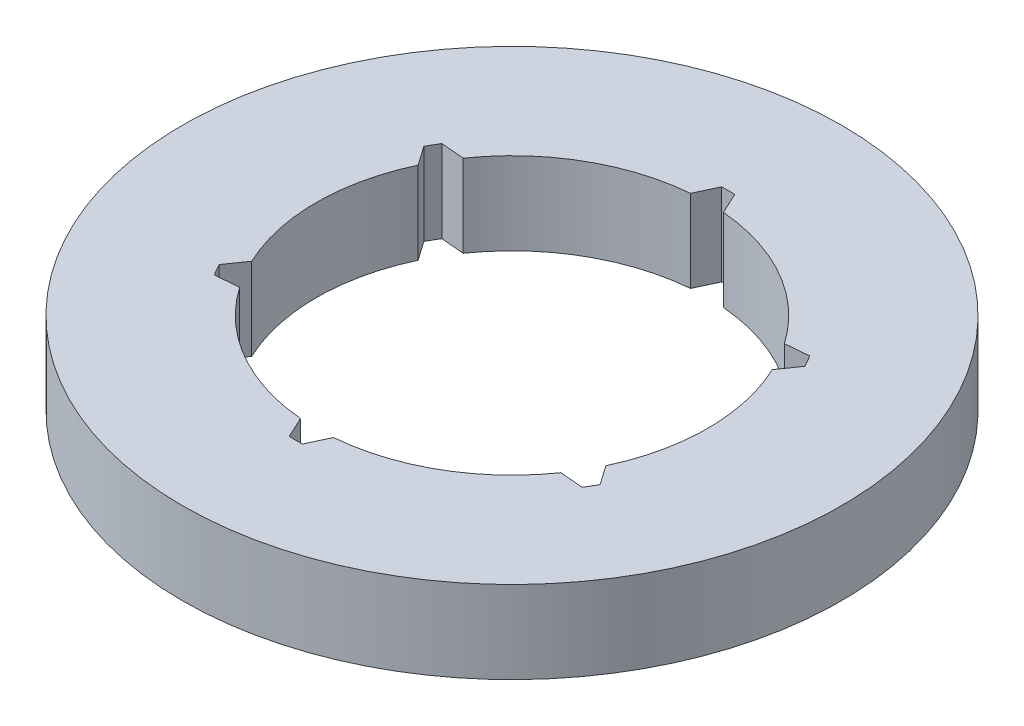
from build123d import *

# Parameters (mm, degrees)
SKETCH1_R           = 40
BOSS_EXTRUDE1_DEPTH = 10


with BuildPart() as part:
    # Sketch1 → Boss-Extrude1 (new body)
    with BuildSketch(Plane(origin=(0, 0, 0), x_dir=(1, 0, 0), z_dir=(0, 1, 0))):
        with Locations(Location((0, 0, 0), (0, 0, 270))):
            Circle(SKETCH1_R)
        with BuildLine():
            Line((-2, 23.665639649), (-0.800587161, 26.237788783))
            ThreePointArc((-0.800587161, 26.237788783), (0, 26.25), (0.800587161, 26.237788783))
            Line((0.800587161, 26.237788783), (2, 23.665639649))
            ThreePointArc((2, 23.665639649), (11.875, 20.56810334), (19.495045133, 13.564870632))
            Line((19.495045133, 13.564870632), (22.322298044, 13.812223211))
            ThreePointArc((22.322298044, 13.812223211), (22.733166849, 13.125), (23.122885205, 12.425565572))
            Line((23.122885205, 12.425565572), (21.495045133, 10.100769017))
            ThreePointArc((21.495045133, 10.100769017), (23.75, 0), (21.495045133, -10.100769017))
            Line((21.495045133, -10.100769017), (23.122885205, -12.425565572))
            ThreePointArc((23.122885205, -12.425565572), (22.733166849, -13.125), (22.322298044, -13.812223211))
            Line((22.322298044, -13.812223211), (19.495045133, -13.564870632))
            ThreePointArc((19.495045133, -13.564870632), (11.875, -20.56810334), (2, -23.665639649))
            Line((2, -23.665639649), (0.800587161, -26.237788783))
            ThreePointArc((0.800587161, -26.237788783), (0, -26.25), (-0.800587161, -26.237788783))
            Line((-0.800587161, -26.237788783), (-2, -23.665639649))
            ThreePointArc((-2, -23.665639649), (-11.875, -20.56810334), (-19.495045133, -13.564870632))
            Line((-19.495045133, -13.564870632), (-22.322298044, -13.812223211))
            ThreePointArc((-22.322298044, -13.812223211), (-22.733166849, -13.125), (-23.122885205, -12.425565572))
            Line((-23.122885205, -12.425565572), (-21.495045133, -10.100769017))
            ThreePointArc((-21.495045133, -10.100769017), (-23.75, 0), (-21.495045133, 10.100769017))
            Line((-21.495045133, 10.100769017), (-23.122885205, 12.425565572))
            ThreePointArc((-23.122885205, 12.425565572), (-22.733166849, 13.125), (-22.322298044, 13.812223211))
            Line((-22.322298044, 13.812223211), (-19.495045133, 13.564870632))
            ThreePointArc((-19.495045133, 13.564870632), (-11.875, 20.56810334), (-2, 23.665639649))
        make_face(mode=Mode.SUBTRACT)
    extrude(amount=BOSS_EXTRUDE1_DEPTH)


solid = part.part
